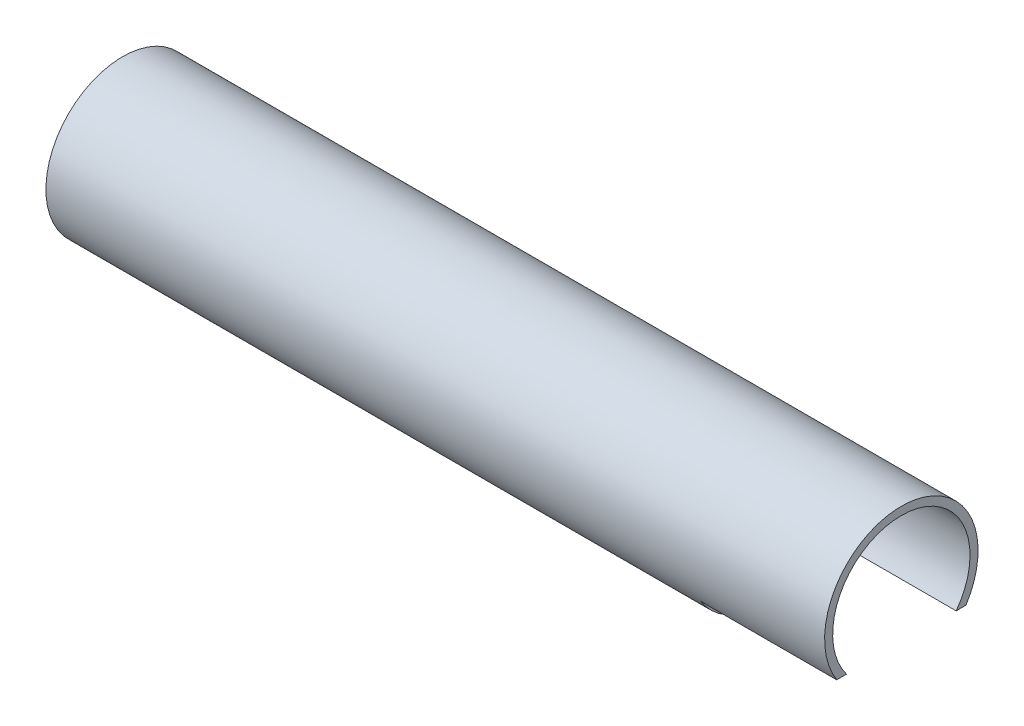
from build123d import *

# Parameters (mm, degrees)
CROQUIS1_R              = 57.15
CROQUIS1_R_2            = 51.15
SALIENTE_EXTRUIR1_DEPTH = 580
CORTAR_EXTRUIR1_START   = -101.6
CORTAR_EXTRUIR1_DEPTH   = 101.6


with BuildPart() as part:
    # Croquis1 → Saliente-Extruir1 (new body)
    with BuildSketch(Plane(origin=(0, 0, 0), x_dir=(0, 0, -1), z_dir=(1, 0, 0))):
        Circle(CROQUIS1_R)
        Circle(CROQUIS1_R_2, mode=Mode.SUBTRACT)
    extrude(amount=SALIENTE_EXTRUIR1_DEPTH)

    # Croquis2 → Cortar-Extruir1 (cut)
    with BuildSketch(Plane(origin=(580, 0, 0), x_dir=(0, 0, -1), z_dir=(1, 0, 0)).offset(CORTAR_EXTRUIR1_START)):
        with BuildLine():
            Line((-48.140237847, -30.8), (48.140237847, -30.8))
            ThreePointArc((48.140237847, -30.8), (0, -57.15), (-48.140237847, -30.8))
        make_face()
    extrude(amount=CORTAR_EXTRUIR1_DEPTH, mode=Mode.SUBTRACT)


solid = part.part
